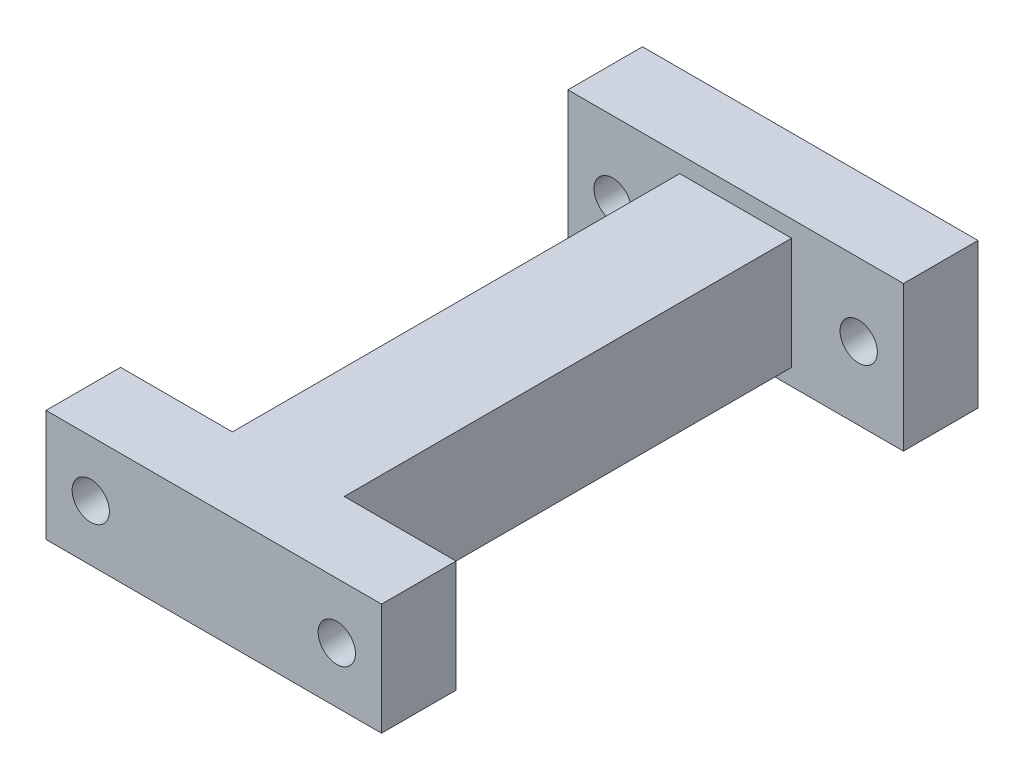
from build123d import *

# Parameters (mm, degrees)
SKETCH_1_W          = 15
SKETCH_1_H          = 15
EXTRUDE_1_DEPTH     = 80
SKETCH_2_W          = 45
SKETCH_2_H          = 15
EXTRUDE_2_DEPTH     = 10
SKETCH_3_R          = 2.5
CUT_EXTRUDE_1_DEPTH = 20
SKETCH_5_W          = 45
SKETCH_5_H          = 19.472765692
EXTRUDE_3_DEPTH     = 10
SKETCH_6_R          = 2.5
CUT_EXTRUDE_2_DEPTH = 84.672260343


with BuildPart() as part:
    # 草图1 → 凸台-拉伸1 (new body)
    with BuildSketch(Plane.XY):
        Rectangle(SKETCH_1_W, SKETCH_1_H)
    extrude(amount=EXTRUDE_1_DEPTH)

    # 草图2 → 凸台-拉伸2 (add)
    with BuildSketch(Plane.XY.offset(80)):
        Rectangle(SKETCH_2_W, SKETCH_2_H)
    extrude(amount=-EXTRUDE_2_DEPTH)

    # 草图3 → 切除-拉伸1 (cut)
    with BuildSketch(Plane.XY.offset(80)):
        with Locations((-16.5, 0)):
            Circle(SKETCH_3_R)
        with Locations((16.5, 0)):
            Circle(SKETCH_3_R)
    extrude(amount=-CUT_EXTRUDE_1_DEPTH, mode=Mode.SUBTRACT)

    # 草图5 → 凸台-拉伸3 (add)
    with BuildSketch(Plane(origin=(0, 0, 0), x_dir=(-1, 0, 0), z_dir=(0, 0, -1))):
        Rectangle(SKETCH_5_W, SKETCH_5_H)
    extrude(amount=-EXTRUDE_3_DEPTH)

    # 草图6 → 切除-拉伸2 (cut, through all)
    with BuildSketch(Plane(origin=(0, 0, 0), x_dir=(-1, 0, 0), z_dir=(0, 0, -1))):
        with Locations(Location((-16.5, 0, 0), (0, 0, 180))):
            Circle(SKETCH_6_R)
        with Locations(Location((16.5, 0, 0), (0, 0, 180))):
            Circle(SKETCH_6_R)
    extrude(amount=-CUT_EXTRUDE_2_DEPTH, mode=Mode.SUBTRACT)


solid = part.part
